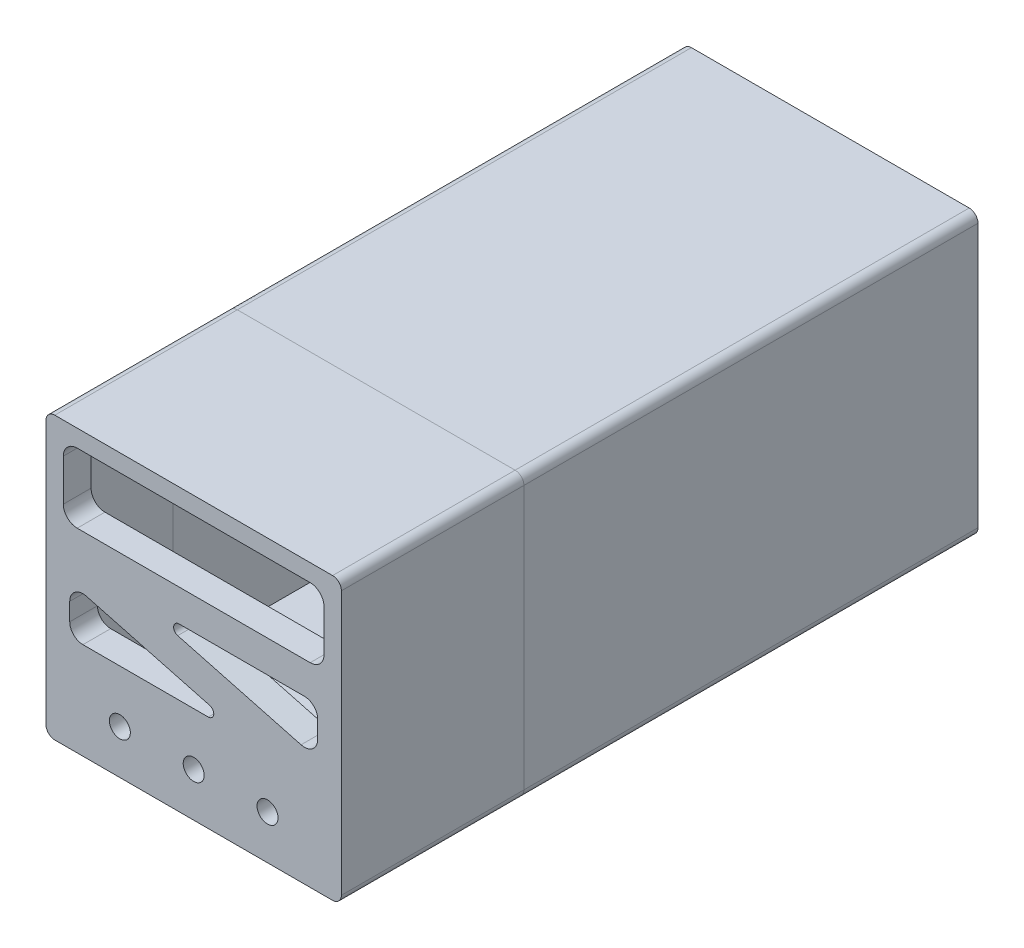
from build123d import *

# Parameters (mm, degrees)
SKETCH1_W           = 85.216
SKETCH1_H           = 81.152
BOSS_EXTRUDE1_DEPTH = 175.656
SHELL2_T            = -4
SHELL3_T            = -4
FILLET1_R           = 2.54
FILLET2_R           = 2.54
SKETCH4_W           = 81.216
SKETCH4_H           = 77.152
SKETCH4_W_2         = 77.216
SKETCH4_H_2         = 73.152
BOSS_EXTRUDE2_DEPTH = 20
SKETCH5_W           = 81.978
SKETCH5_H           = 77.914
SKETCH5_W_2         = 77.216
SKETCH5_H_2         = 73.152
CUT_EXTRUDE2_DEPTH  = 20
SKETCH6_W           = 75.216
SKETCH6_H           = 20
CUT_EXTRUDE3_DEPTH  = 4
FILLET3_R           = 4
BOSS_EXTRUDE3_START = 4
BOSS_EXTRUDE3_DEPTH = 4
BOSS_EXTRUDE4_DEPTH = 4
SKETCH9_R           = 3.025
CUT_EXTRUDE4_DEPTH  = 6
SKETCH10_W          = 77.216
SKETCH10_H          = 73.152
BOSS_EXTRUDE5_DEPTH = 4.500000096
CUT_EXTRUDE5_DEPTH  = 12.500000096
CUT_EXTRUDE6_DEPTH  = 8


with BuildPart() as part:
    # Sketch1 → Boss-Extrude1 (new body)
    with BuildSketch(Plane.XY):
        Rectangle(SKETCH1_W, SKETCH1_H)
    extrude(amount=BOSS_EXTRUDE1_DEPTH)


with BuildPart() as body_2:
    # Split1: the piece on the far side of the plane
    add(part.part)
    split(bisect_by=Plane(origin=(0, 0, 127), x_dir=(-1, 0, 0), z_dir=(0, 0, -1)), keep=Keep.BOTTOM)

    # Shell3
    shell3_openings = [body_2.faces().sort_by_distance(p)[0] for p in [
        (0, 0, 127),
    ]]
    offset(amount=SHELL3_T, openings=shell3_openings, kind=Kind.INTERSECTION)

    # Fillet2
    fillet2_edges = [body_2.edges().sort_by_distance(p)[0] for p in [
        (-42.608, 40.576, 151.328),
        (42.608, 40.576, 151.328),
        (42.608, -40.576, 151.328),
        (-42.608, -40.576, 151.328),
    ]]
    fillet(fillet2_edges, radius=FILLET2_R)

    # Sketch5 → Cut-Extrude2 (cut)
    with BuildSketch(Plane(origin=(0, 0, 127), x_dir=(-1, 0, 0), z_dir=(0, 0, -1))):
        Rectangle(SKETCH5_W, SKETCH5_H)
        Rectangle(SKETCH5_W_2, SKETCH5_H_2, mode=Mode.SUBTRACT)
    extrude(amount=-CUT_EXTRUDE2_DEPTH, mode=Mode.SUBTRACT)

    # Sketch6 → Cut-Extrude3 (cut)
    with BuildSketch(Plane.XY.offset(175.656)):
        with Locations((0, 25.576)):
            Rectangle(SKETCH6_W, SKETCH6_H)
    extrude(amount=-CUT_EXTRUDE3_DEPTH, mode=Mode.SUBTRACT)

    # Fillet3
    fillet3_edges = [body_2.edges().sort_by_distance(p)[0] for p in [
        (37.608, 35.576, 173.656),
        (37.608, 15.576, 173.656),
        (-37.608, 15.576, 173.656),
        (-37.608, 35.576, 173.656),
    ]]
    fillet(fillet3_edges, radius=FILLET3_R)

    # Sketch7 → Boss-Extrude3 (add)
    with BuildSketch(Plane.XY.offset(175.656).offset(BOSS_EXTRUDE3_START)):
        with BuildLine():
            Line((-42.608, 38.036), (-42.608, -38.036))
            ThreePointArc((-42.608, -38.036), (-41.864051224, -39.832051224), (-40.068, -40.576))
            Line((-40.068, -40.576), (40.068, -40.576))
            ThreePointArc((40.068, -40.576), (41.864051224, -39.832051224), (42.608, -38.036))
            Line((42.608, -38.036), (42.608, 38.036))
            ThreePointArc((42.608, 38.036), (41.864051224, 39.832051224), (40.068, 40.576))
            Line((40.068, 40.576), (-40.068, 40.576))
            ThreePointArc((-40.068, 40.576), (-41.864051224, 39.832051224), (-42.608, 38.036))
        make_face()
        with BuildLine():
            Line((-33.608, 15.576), (33.608, 15.576))
            ThreePointArc((33.608, 15.576), (36.436427125, 16.747572875), (37.608, 19.576))
            Line((37.608, 19.576), (37.608, 31.576))
            ThreePointArc((37.608, 31.576), (36.436427125, 34.404427125), (33.608, 35.576))
            Line((33.608, 35.576), (-33.608, 35.576))
            ThreePointArc((-33.608, 35.576), (-36.436427125, 34.404427125), (-37.608, 31.576))
            Line((-37.608, 31.576), (-37.608, 19.576))
            ThreePointArc((-37.608, 19.576), (-36.436427125, 16.747572875), (-33.608, 15.576))
        make_face(mode=Mode.SUBTRACT)
    extrude(amount=-BOSS_EXTRUDE3_DEPTH)

    # Sketch9 → Cut-Extrude4 (cut)
    with BuildSketch(Plane.XY.offset(179.656)):
        with Locations((-21.304, -27.876)):
            Circle(SKETCH9_R)
        with Locations((0, -27.876)):
            Circle(SKETCH9_R)
        with Locations((21.304, -27.876)):
            Circle(SKETCH9_R)
    cut_extrude4 = extrude(amount=-CUT_EXTRUDE4_DEPTH, mode=Mode.SUBTRACT)

    # Sketch12 → Cut-Extrude6 (cut)
    with BuildSketch(Plane.XY.offset(179.656)):
        with BuildLine():
            Line((-30.972571902, -0.100195505), (4.615140384, -9.578475727))
            ThreePointArc((4.615140384, -9.578475727), (5.780649168, -11.318525139), (4.206574871, -12.7))
            Line((4.206574871, -12.7), (-31.953129133, -12.7))
            ThreePointArc((-31.953129133, -12.7), (-34.64720597, -11.584076836), (-35.763129133, -8.89))
            Line((-35.763129133, -8.89), (-35.763129133, -3.781853761))
            ThreePointArc((-35.763129133, -3.781853761), (-34.274785541, -0.760924844), (-30.972571902, -0.100195505))
        make_face()
        with BuildLine():
            Line((-4.206574871, 6.35), (31.953129133, 6.35))
            ThreePointArc((31.953129133, 6.35), (34.64720597, 5.234076836), (35.763129133, 2.54))
            Line((35.763129133, 2.54), (35.763129133, -2.568146239))
            ThreePointArc((35.763129133, -2.568146239), (34.274785541, -5.589075156), (30.972571902, -6.249804495))
            Line((30.972571902, -6.249804495), (-4.615140384, 3.228475727))
            ThreePointArc((-4.615140384, 3.228475727), (-5.780649168, 4.968525139), (-4.206574871, 6.35))
        make_face()
    extrude(amount=-CUT_EXTRUDE6_DEPTH, mode=Mode.SUBTRACT)


with BuildPart() as part_1:
    add(part.part)

    # Split1
    split(bisect_by=Plane(origin=(0, 0, 127), x_dir=(-1, 0, 0), z_dir=(0, 0, -1)), keep=Keep.TOP)

    # Shell2
    shell2_openings = [part_1.faces().sort_by_distance(p)[0] for p in [
        (0, 0, 127),
    ]]
    offset(amount=SHELL2_T, openings=shell2_openings, kind=Kind.INTERSECTION)

    # Fillet1
    fillet1_edges = [part_1.edges().sort_by_distance(p)[0] for p in [
        (-42.608, 40.576, 63.5),
        (42.608, 40.576, 63.5),
        (42.608, -40.576, 63.5),
        (-42.608, -40.576, 63.5),
    ]]
    fillet(fillet1_edges, radius=FILLET1_R)

    # Sketch4 → Boss-Extrude2 (add)
    with BuildSketch(Plane.XY.offset(127)):
        Rectangle(SKETCH4_W, SKETCH4_H)
        Rectangle(SKETCH4_W_2, SKETCH4_H_2, mode=Mode.SUBTRACT)
    extrude(amount=BOSS_EXTRUDE2_DEPTH)

    # Sketch8 → Boss-Extrude4 (add)
    with BuildSketch(Plane(origin=(0, 0, 0), x_dir=(-1, 0, 0), z_dir=(0, 0, -1))):
        with BuildLine():
            Line((40.068, 40.576), (-40.068, 40.576))
            ThreePointArc((-40.068, 40.576), (-41.864051224, 39.832051224), (-42.608, 38.036))
            Line((-42.608, 38.036), (-42.608, -38.036))
            ThreePointArc((-42.608, -38.036), (-41.864051224, -39.832051224), (-40.068, -40.576))
            Line((-40.068, -40.576), (40.068, -40.576))
            ThreePointArc((40.068, -40.576), (41.864051224, -39.832051224), (42.608, -38.036))
            Line((42.608, -38.036), (42.608, 38.036))
            ThreePointArc((42.608, 38.036), (41.864051224, 39.832051224), (40.068, 40.576))
        make_face()
    extrude(amount=BOSS_EXTRUDE4_DEPTH)

    # Mirror1: Cut-Extrude4 across plane
    add(cut_extrude4.mirror(Plane.XY.offset(87.828)), mode=Mode.SUBTRACT)

    # Sketch10 → Boss-Extrude5 (add)
    with BuildSketch(Plane.XY.offset(4)):
        Rectangle(SKETCH10_W, SKETCH10_H)
    extrude(amount=BOSS_EXTRUDE5_DEPTH)

    # Sketch11 → Cut-Extrude5 (cut)
    with BuildSketch(Plane(origin=(0, 0, -4), x_dir=(-1, 0, 0), z_dir=(0, 0, -1))):
        with BuildLine():
            ThreePointArc((29.908, 24.066), (28.792076836, 26.760076836), (26.098, 27.876))
            Line((26.098, 27.876), (11.727473696, 27.876))
            ThreePointArc((11.727473696, 27.876), (8.103904131, 25.243218589), (9.488243538, 20.983476959))
            Line((9.488243538, 20.983476959), (23.858769841, 10.544328421))
            ThreePointArc((23.858769841, 10.544328421), (27.827831364, 10.232181603), (29.908, 13.626851462))
            Line((29.908, 13.626851462), (29.908, 24.066))
        make_face()
        with BuildLine():
            ThreePointArc((-23.858769841, 1.819526927), (-27.827831364, 2.131673746), (-29.908, -1.262996113))
            Line((-29.908, -1.262996113), (-29.908, -11.766))
            ThreePointArc((-29.908, -11.766), (-28.792076836, -14.460076836), (-26.098, -15.576))
            Line((-26.098, -15.576), (-11.639570458, -15.576))
            ThreePointArc((-11.639570458, -15.576), (-8.016000893, -12.943218589), (-9.400340299, -8.683476959))
            Line((-9.400340299, -8.683476959), (-23.858769841, 1.819526927))
        make_face()
        with BuildLine():
            ThreePointArc((22.443899471, -18.002473668), (31.313488137, -16.596985531), (29.908, -7.727396865))
            Line((29.908, -7.727396865), (-22.443899471, 30.302473668))
            ThreePointArc((-22.443899471, 30.302473668), (-31.313488137, 28.896985531), (-29.908, 20.027396865))
            Line((-29.908, 20.027396865), (22.443899471, -18.002473668))
        make_face()
    extrude(amount=-CUT_EXTRUDE5_DEPTH, mode=Mode.SUBTRACT)


solid = Compound([body_2.part, part_1.part])
